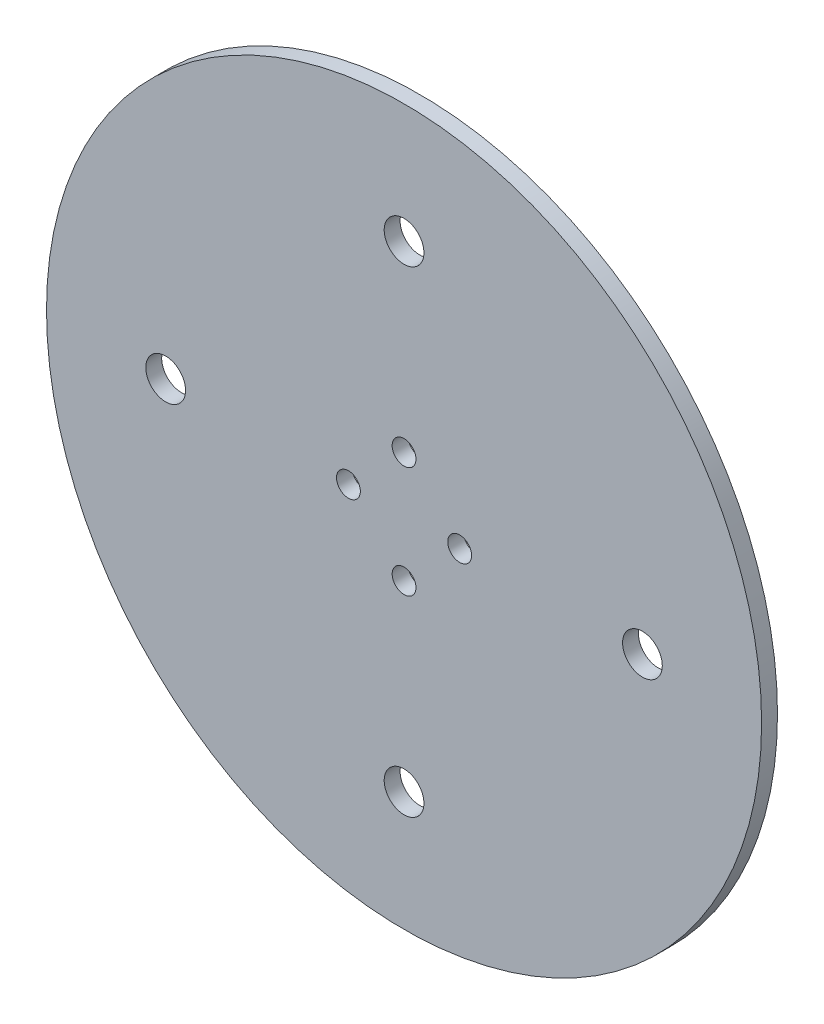
from build123d import *

# Parameters (mm, degrees)
SKETCH1_R           = 45
SKETCH1_R_2         = 1.5
SKETCH1_R_3         = 2.5
BOSS_EXTRUDE1_DEPTH = 2


with BuildPart() as part:
    # Sketch1 → Boss-Extrude1 (new body)
    with BuildSketch(Plane.XY):
        Circle(SKETCH1_R)
        with Locations((0, 7)):
            Circle(SKETCH1_R_2, mode=Mode.SUBTRACT)
        with Locations((7, 0)):
            Circle(SKETCH1_R_2, mode=Mode.SUBTRACT)
        with Locations((0, -7)):
            Circle(SKETCH1_R_2, mode=Mode.SUBTRACT)
        with Locations((-7, 0)):
            Circle(SKETCH1_R_2, mode=Mode.SUBTRACT)
        with Locations((0, 30)):
            Circle(SKETCH1_R_3, mode=Mode.SUBTRACT)
        with Locations((30, 0)):
            Circle(SKETCH1_R_3, mode=Mode.SUBTRACT)
        with Locations((0, -30)):
            Circle(SKETCH1_R_3, mode=Mode.SUBTRACT)
        with Locations((-30, 0)):
            Circle(SKETCH1_R_3, mode=Mode.SUBTRACT)
    extrude(amount=BOSS_EXTRUDE1_DEPTH)


solid = part.part
